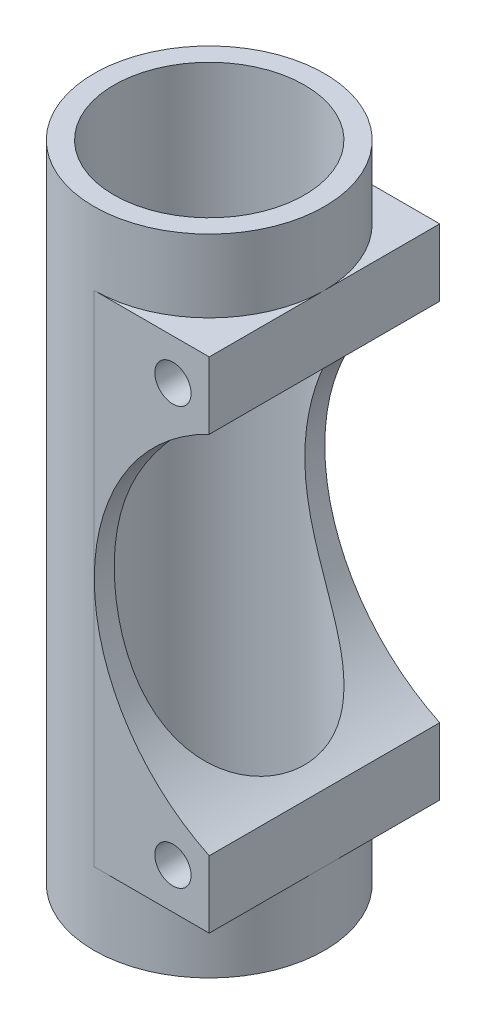
from build123d import *

# Parameters (mm, degrees)
SKETCH1_R               = 12.7
SKETCH1_R_2             = 10.5
BOSS_EXTRUDE1_DEPTH     = 71
BOSS_EXTRUDE2_DEPTH     = 63
CUT_EXTRUDE1_DEPTH      = 8
CUT_EXTRUDE2_DEPTH      = 15
CUT_EXTRUDE2_DEPTH_BACK = 16
SKETCH4_R               = 22.297733005
SKETCH5_R               = 2
CUT_EXTRUDE3_DEPTH      = 4
CUT_EXTRUDE4_START      = -4
SKETCH6_R               = 2
CUT_EXTRUDE4_DEPTH      = 4


with BuildPart() as part:
    # Sketch1 → Boss-Extrude1 (new body)
    with BuildSketch(Plane(origin=(0, 0, 0), x_dir=(1, 0, 0), z_dir=(0, 1, 0))):
        with Locations(Location((0, 0, 0), (0, 0, 270))):
            Circle(SKETCH1_R)
        with Locations(Location((0, 0, 0), (0, 0, 270))):
            Circle(SKETCH1_R_2, mode=Mode.SUBTRACT)
    extrude(amount=BOSS_EXTRUDE1_DEPTH)

    # Sketch2 → Boss-Extrude2 (add)
    with BuildSketch(Plane.XZ):
        with BuildLine():
            Line((12.7, 12.7), (0, 12.7))
            ThreePointArc((0, 12.7), (8.980256121, 8.980256121), (12.7, 0))
            Line((12.7, 0), (12.7, 12.7))
        make_face()
        with BuildLine():
            Line((12.7, -12.7), (12.7, 0))
            ThreePointArc((12.7, 0), (8.980256121, -8.980256121), (0, -12.7))
            Line((0, -12.7), (12.7, -12.7))
        make_face()
    extrude(amount=-BOSS_EXTRUDE2_DEPTH)

    # Sketch3 → Cut-Extrude1 (cut)
    with BuildSketch(Plane.XZ):
        with BuildLine():
            Line((12.7, 12.7), (0, 12.7))
            ThreePointArc((0, 12.7), (8.980256109, 8.980256133), (12.7, 3.4e-08))
            Line((12.7, 3.4e-08), (12.7, 12.7))
        make_face()
        with BuildLine():
            Line((12.7, -12.7), (12.7, 3.4e-08))
            ThreePointArc((12.7, 3.4e-08), (8.980256133, -8.980256109), (0, -12.7))
            Line((0, -12.7), (12.7, -12.7))
        make_face()
    extrude(amount=-CUT_EXTRUDE1_DEPTH, mode=Mode.SUBTRACT)

    # Sketch4 → Cut-Extrude2 (cut, two sides: drawn at the far end of the back side and taken through both)
    with BuildSketch(Plane.XY.offset(-CUT_EXTRUDE2_DEPTH_BACK)):
        with Locations((22.331187996, 35.5)):
            Circle(SKETCH4_R)
    extrude(amount=CUT_EXTRUDE2_DEPTH + CUT_EXTRUDE2_DEPTH_BACK, mode=Mode.SUBTRACT)

    # Sketch5 → Cut-Extrude3 (cut)
    with BuildSketch(Plane(origin=(0, 0, -12.7), x_dir=(-1, 0, 0), z_dir=(0, 0, -1))):
        with Locations((-8.7, 58.5)):
            Circle(SKETCH5_R)
        with Locations((-8.7, 12.5)):
            Circle(SKETCH5_R)
    extrude(amount=-CUT_EXTRUDE3_DEPTH, mode=Mode.SUBTRACT)

    # Sketch6 → Cut-Extrude4 (cut)
    with BuildSketch(Plane.XY.offset(12.7).offset(CUT_EXTRUDE4_START)):
        with Locations(Location((8.7, 58.5, 0), (0, 0, 180))):
            Circle(SKETCH6_R)
        with Locations(Location((8.7, 12.5, 0), (0, 0, 180))):
            Circle(SKETCH6_R)
    extrude(amount=CUT_EXTRUDE4_DEPTH, mode=Mode.SUBTRACT)


solid = part.part
